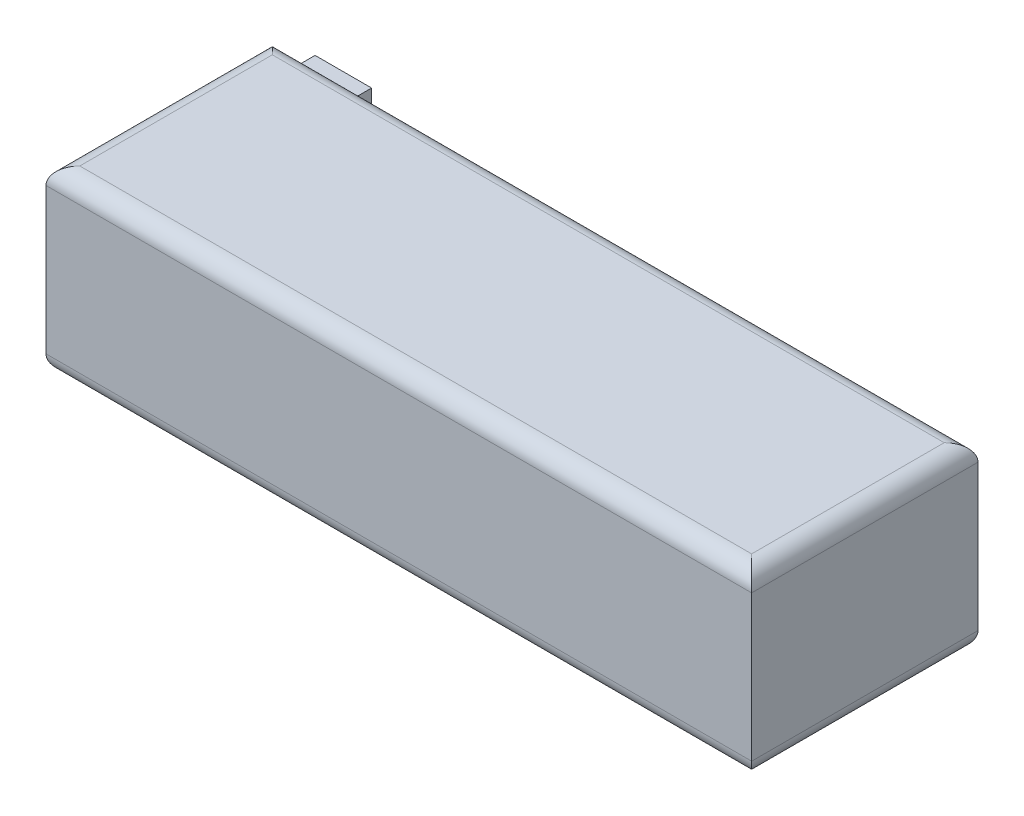
from build123d import *

# Parameters (mm, degrees)
SKETCH1_W           = 106.1085
SKETCH1_H           = 34.036
BOSS_EXTRUDE1_DEPTH = 13.5001
FILLET1_R           = 2.54
SKETCH4_W           = 8.4963
SKETCH4_H           = 11.938
BOSS_EXTRUDE2_DEPTH = 8.128
FILLET2_R           = 2.54


with BuildPart() as part:
    # Sketch1 → Boss-Extrude1 (new, symmetric)
    with BuildSketch(Plane(origin=(0, 0, 0), x_dir=(1, 0, 0), z_dir=(0, 1, 0))):
        Rectangle(SKETCH1_W, SKETCH1_H)
    extrude(amount=BOSS_EXTRUDE1_DEPTH, both=True)

    # Fillet1
    fillet1_edges = [part.edges().sort_by_distance(p)[0] for p in [
        (-53.05425, 13.5001, 0),
        (0, 13.5001, 17.018),
        (53.05425, 13.5001, 0),
        (0, -13.5001, 17.018),
        (-53.05425, -13.5001, 0),
        (0, -13.5001, -17.018),
        (53.05425, -13.5001, 0),
        (0, 13.5001, -17.018),
    ]]
    fillet(fillet1_edges, radius=FILLET1_R)

    # Sketch4 → Boss-Extrude2 (add)
    with BuildSketch(Plane(origin=(0, 0, -17.018), x_dir=(-1, 0, 0), z_dir=(0, 0, -1))):
        with Locations((50.5079, 0)):
            Rectangle(SKETCH4_W, SKETCH4_H)
    extrude(amount=BOSS_EXTRUDE2_DEPTH)

    # Fillet2
    fillet2_edges = [part.edges().sort_by_distance(p)[0] for p in [
        (-49.657, 5.969, -17.018),
        (-46.25975, 0, -17.018),
        (-49.657, -5.969, -17.018),
    ]]
    fillet(fillet2_edges, radius=FILLET2_R)


solid = part.part
